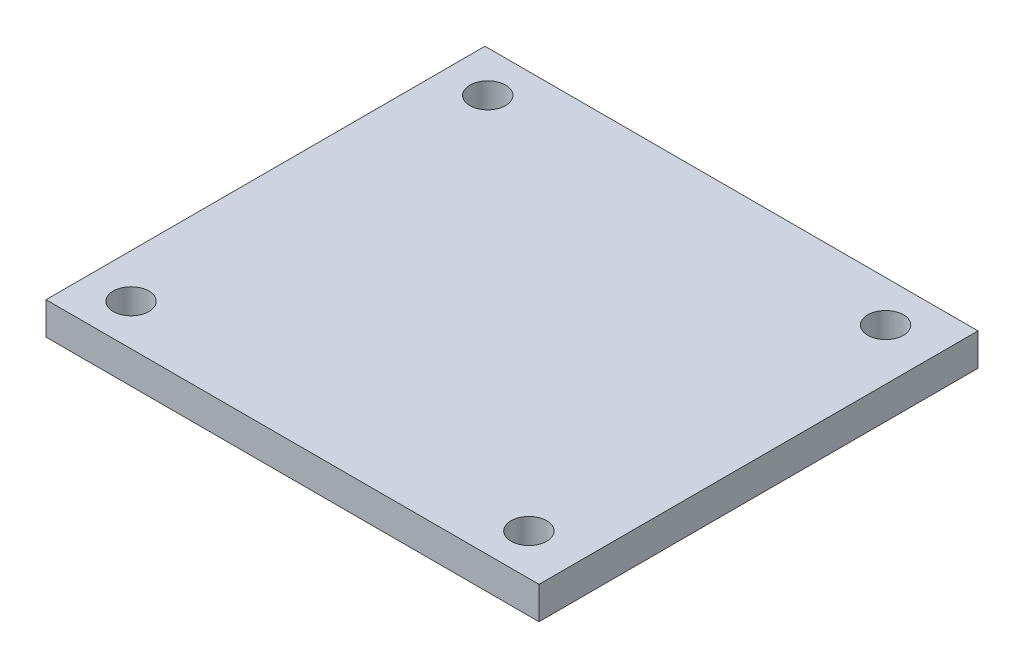
from build123d import *

# Parameters (mm, degrees)
SKETCH1_W           = 22.82
SKETCH1_H           = 20.32
BOSS_EXTRUDE1_DEPTH = 1.5
SKETCH2_R           = 0.825
CUT_EXTRUDE1_DEPTH  = 31.592561187


with BuildPart() as part:
    # Sketch1 → Boss-Extrude1 (new body)
    with BuildSketch(Plane(origin=(0, 0, 0), x_dir=(1, 0, 0), z_dir=(0, 1, 0))):
        with Locations((-11.41, 10.16)):
            Rectangle(SKETCH1_W, SKETCH1_H)
    extrude(amount=BOSS_EXTRUDE1_DEPTH)

    # Sketch2 → Cut-Extrude1 (cut, through all)
    with BuildSketch(Plane(origin=(0, 1.5, 0), x_dir=(1, 0, 0), z_dir=(0, 1, 0))):
        with Locations(Location((-2.373, 18.415, 0), (0, 0, 270))):
            Circle(SKETCH2_R)
        with Locations(Location((-20.788, 18.415, 0), (0, 0, 270))):
            Circle(SKETCH2_R)
        with Locations(Location((-20.788, 1.905, 0), (0, 0, 270))):
            Circle(SKETCH2_R)
        with Locations(Location((-2.373, 1.905, 0), (0, 0, 270))):
            Circle(SKETCH2_R)
    extrude(amount=-CUT_EXTRUDE1_DEPTH, mode=Mode.SUBTRACT)


solid = part.part
